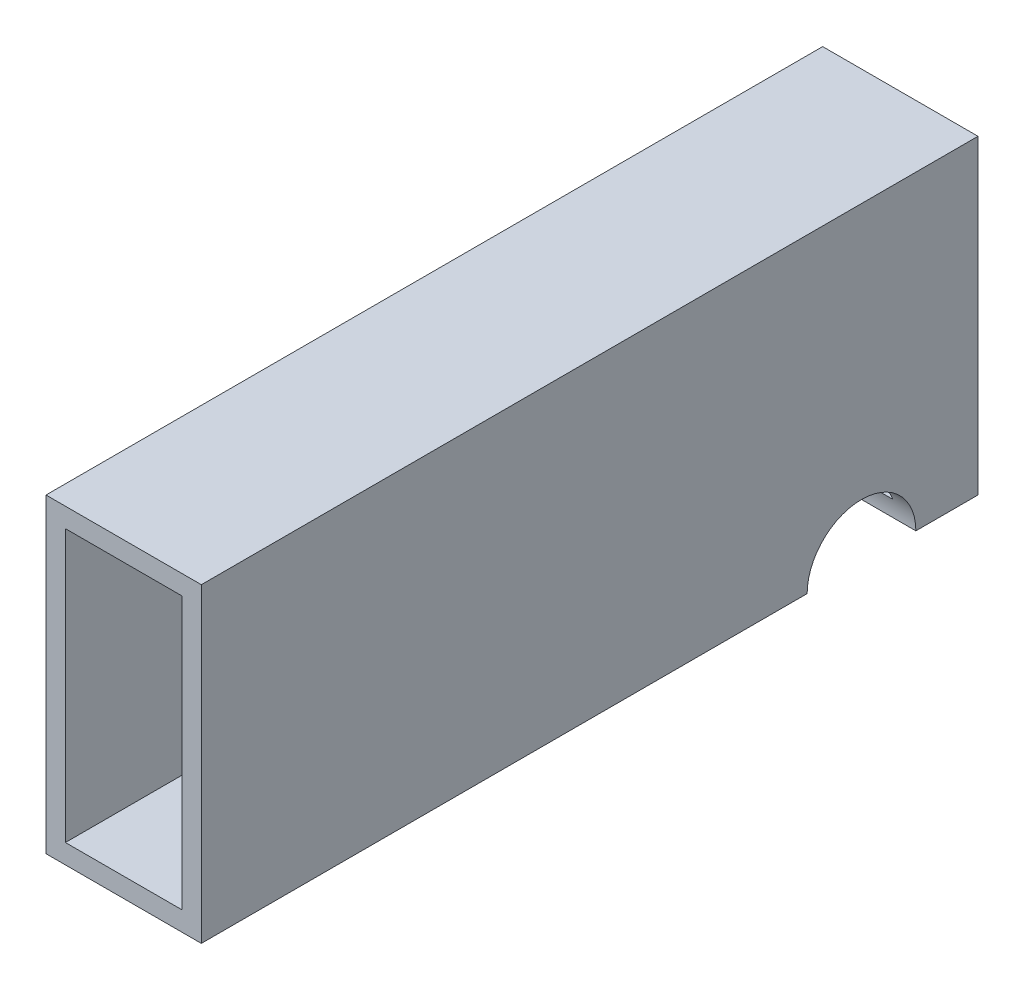
from build123d import *

# Parameters (mm, degrees)
SKETCH1_W           = 25.4
SKETCH1_H           = 50.8
SKETCH1_W_2         = 19.05
SKETCH1_H_2         = 44.45
BOSS_EXTRUDE1_DEPTH = 63.5
SKETCH2_R           = 8.89
CUT_EXTRUDE1_DEPTH  = 73.955945611


with BuildPart() as part:
    # Sketch1 → Boss-Extrude1 (new, symmetric)
    with BuildSketch(Plane.XY):
        Rectangle(SKETCH1_W, SKETCH1_H)
        Rectangle(SKETCH1_W_2, SKETCH1_H_2, mode=Mode.SUBTRACT)
    extrude(amount=BOSS_EXTRUDE1_DEPTH, both=True)

    # Sketch2 → Cut-Extrude1 (cut, through all)
    with BuildSketch(Plane(origin=(12.7, 0, 0), x_dir=(0, 0, -1), z_dir=(1, 0, 0))):
        with Locations((44.45, -25.4)):
            Circle(SKETCH2_R)
    extrude(amount=-CUT_EXTRUDE1_DEPTH, mode=Mode.SUBTRACT)


solid = part.part
